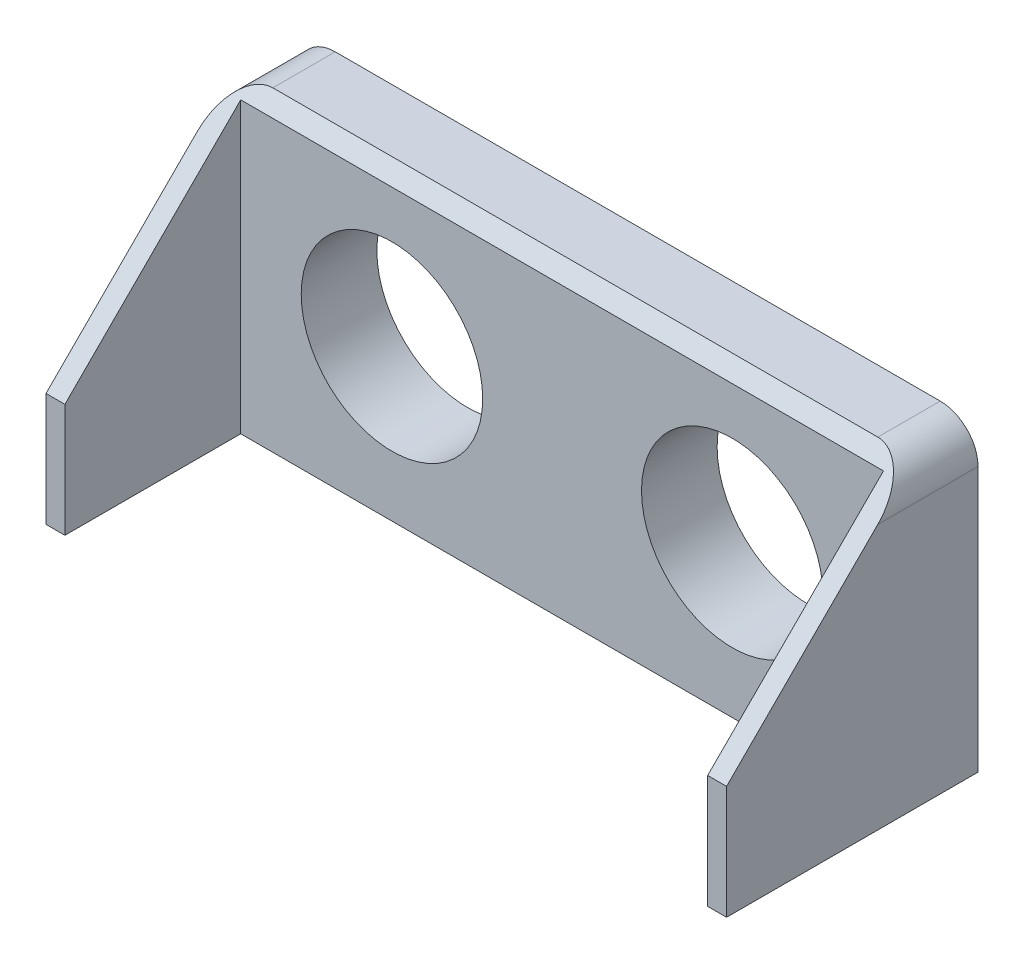
from build123d import *

# Parameters (mm, degrees)
BOSS_EXTRUDE1_DEPTH = 16
CHAMFER1_SIZE       = 10
FILLET1_R           = 2
SKETCH3_R           = 4.8
CUT_EXTRUDE1_DEPTH  = 42.57992304


with BuildPart() as part:
    # Sketch2 → Boss-Extrude1 (new body)
    with BuildSketch(Plane(origin=(0, 0, 0), x_dir=(1, 0, 0), z_dir=(0, 1, 0))):
        Polygon((0, 0), (0, 13.3), (36, 13.3), (36, 0), (35, 0), (35, 9.3), (1, 9.3), (1, 0), align=None)
    extrude(amount=BOSS_EXTRUDE1_DEPTH)

    # Chamfer1
    chamfer1_edges = [part.edges().sort_by_distance(p)[0] for p in [
        (0.5, 16, 0),
    ]]
    chamfer(chamfer1_edges, length=CHAMFER1_SIZE)

    # Fillet1
    fillet1_edges = [part.edges().sort_by_distance(p)[0] for p in [
        (36, 16, -11.65),
        (0, 16, -11.65),
    ]]
    fillet(fillet1_edges, radius=FILLET1_R)

    # Sketch3 → Cut-Extrude1 (cut, through all)
    with BuildSketch(Plane(origin=(0, 0, -13.3), x_dir=(-1, 0, 0), z_dir=(0, 0, -1))):
        with Locations((-27, 8)):
            Circle(SKETCH3_R)
        with Locations((-9, 8)):
            Circle(SKETCH3_R)
    extrude(amount=-CUT_EXTRUDE1_DEPTH, mode=Mode.SUBTRACT)


solid = part.part
